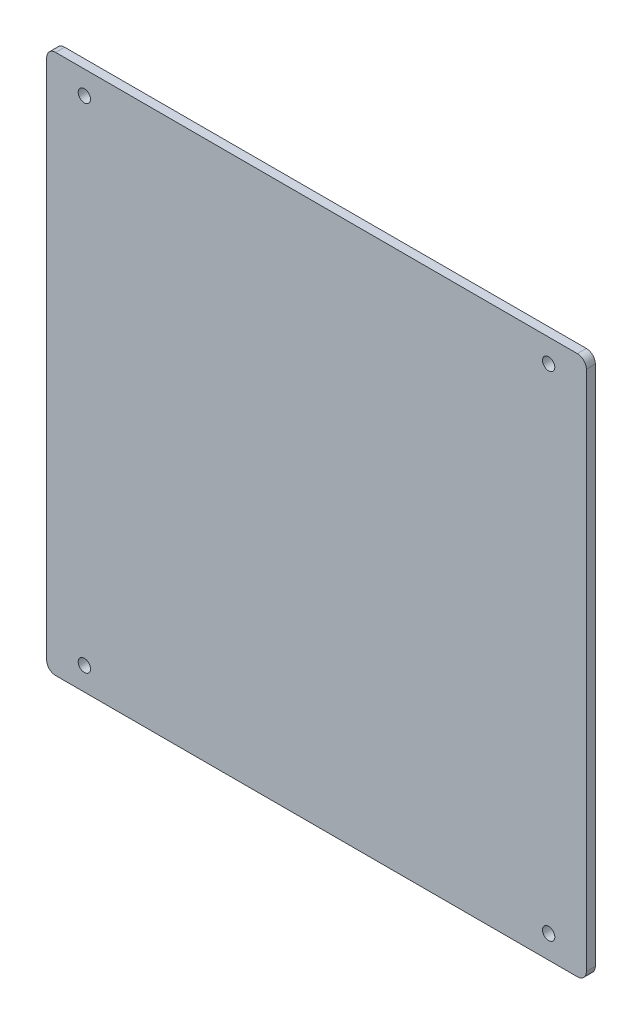
from build123d import *

# Parameters (mm, degrees)
SKETCH1_W           = 180
SKETCH1_H           = 180
BOSS_EXTRUDE1_DEPTH = 3
FILLET1_R           = 3
CUT_EXTRUDE_1_REACH = 129.315
SKETCH_1_R          = 2.05


with BuildPart() as part:
    # Sketch1 → Boss-Extrude1 (new body)
    with BuildSketch(Plane.XY):
        Rectangle(SKETCH1_W, SKETCH1_H)
    extrude(amount=BOSS_EXTRUDE1_DEPTH)

    # Fillet1
    fillet1_edges = [part.edges().sort_by_distance(p)[0] for p in [
        (90, -90, 1.5),
        (-90, -90, 1.5),
        (-90, 90, 1.5),
        (90, 90, 1.5),
    ]]
    fillet(fillet1_edges, radius=FILLET1_R)

    # 草图1 → 切除-拉伸1 (cut, up to next)
    with BuildSketch(Plane.XY.offset(3), mode=Mode.PRIVATE) as cut_extrude_1_sk1:
        with Locations((-77.42949016, 82.268833295)):
            Circle(SKETCH_1_R)
    cut_extrude_1_tool1 = extrude(cut_extrude_1_sk1.sketch, amount=-CUT_EXTRUDE_1_REACH, mode=Mode.PRIVATE) & part.part
    # 草图1 → 切除-拉伸1 (cut, up to next)
    with BuildSketch(Plane.XY.offset(3), mode=Mode.PRIVATE) as cut_extrude_1_sk2:
        with Locations((77.42949016, 82.268833295)):
            Circle(SKETCH_1_R)
    cut_extrude_1_tool2 = extrude(cut_extrude_1_sk2.sketch, amount=-CUT_EXTRUDE_1_REACH, mode=Mode.PRIVATE) & part.part
    # 草图1 → 切除-拉伸1 (cut, up to next)
    with BuildSketch(Plane.XY.offset(3), mode=Mode.PRIVATE) as cut_extrude_1_sk3:
        with Locations((77.42949016, -82.268833295)):
            Circle(SKETCH_1_R)
    cut_extrude_1_tool3 = extrude(cut_extrude_1_sk3.sketch, amount=-CUT_EXTRUDE_1_REACH, mode=Mode.PRIVATE) & part.part
    # 草图1 → 切除-拉伸1 (cut, up to next)
    with BuildSketch(Plane.XY.offset(3), mode=Mode.PRIVATE) as cut_extrude_1_sk4:
        with Locations((-77.42949016, -82.268833295)):
            Circle(SKETCH_1_R)
    cut_extrude_1_tool4 = extrude(cut_extrude_1_sk4.sketch, amount=-CUT_EXTRUDE_1_REACH, mode=Mode.PRIVATE) & part.part
    add(cut_extrude_1_tool1.solids().sort_by_distance((-77.42949, 82.268833, 3))[0], mode=Mode.SUBTRACT)
    add(cut_extrude_1_tool2.solids().sort_by_distance((77.42949, 82.268833, 3))[0], mode=Mode.SUBTRACT)
    add(cut_extrude_1_tool3.solids().sort_by_distance((77.42949, -82.268833, 3))[0], mode=Mode.SUBTRACT)
    add(cut_extrude_1_tool4.solids().sort_by_distance((-77.42949, -82.268833, 3))[0], mode=Mode.SUBTRACT)


solid = part.part
